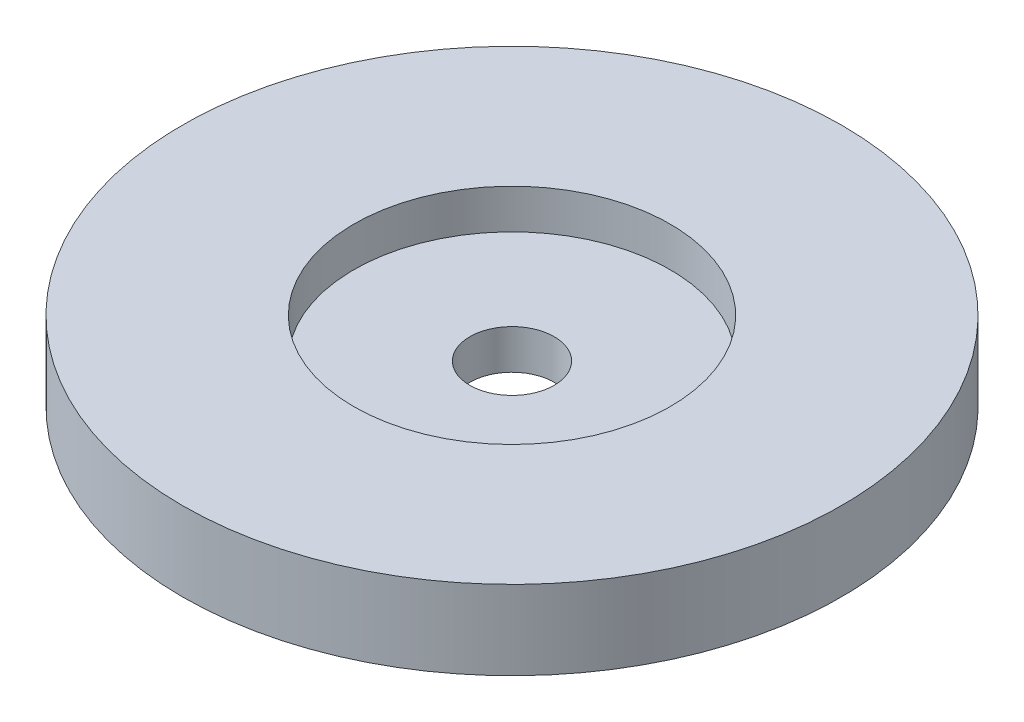
from build123d import *

# Parameters (mm, degrees)
SKETCH_1_R          = 12.5
EXTRUDE_1_DEPTH     = 3
SKETCH_2_R          = 6
CUT_EXTRUDE_1_DEPTH = 1.5
SKETCH_3_R          = 1.6
CUT_EXTRUDE_2_DEPTH = 18.741194999


with BuildPart() as part:
    # 草图1 → 凸台-拉伸1 (new body)
    with BuildSketch(Plane(origin=(0, 0, 0), x_dir=(1, 0, 0), z_dir=(0, 1, 0))):
        with Locations(Location((0, 0, 0), (0, 0, 270))):
            Circle(SKETCH_1_R)
    extrude(amount=EXTRUDE_1_DEPTH)

    # 草图2 → 切除-拉伸1 (cut)
    with BuildSketch(Plane(origin=(0, 3, 0), x_dir=(1, 0, 0), z_dir=(0, 1, 0))):
        with Locations(Location((0, 0, 0), (0, 0, 270))):
            Circle(SKETCH_2_R)
    extrude(amount=-CUT_EXTRUDE_1_DEPTH, mode=Mode.SUBTRACT)

    # 草图3 → 切除-拉伸2 (cut, through all)
    with BuildSketch(Plane(origin=(0, 1.5, 0), x_dir=(1, 0, 0), z_dir=(0, 1, 0))):
        with Locations(Location((0, 0, 0), (0, 0, 270))):
            Circle(SKETCH_3_R)
    extrude(amount=-CUT_EXTRUDE_2_DEPTH, mode=Mode.SUBTRACT)


solid = part.part
